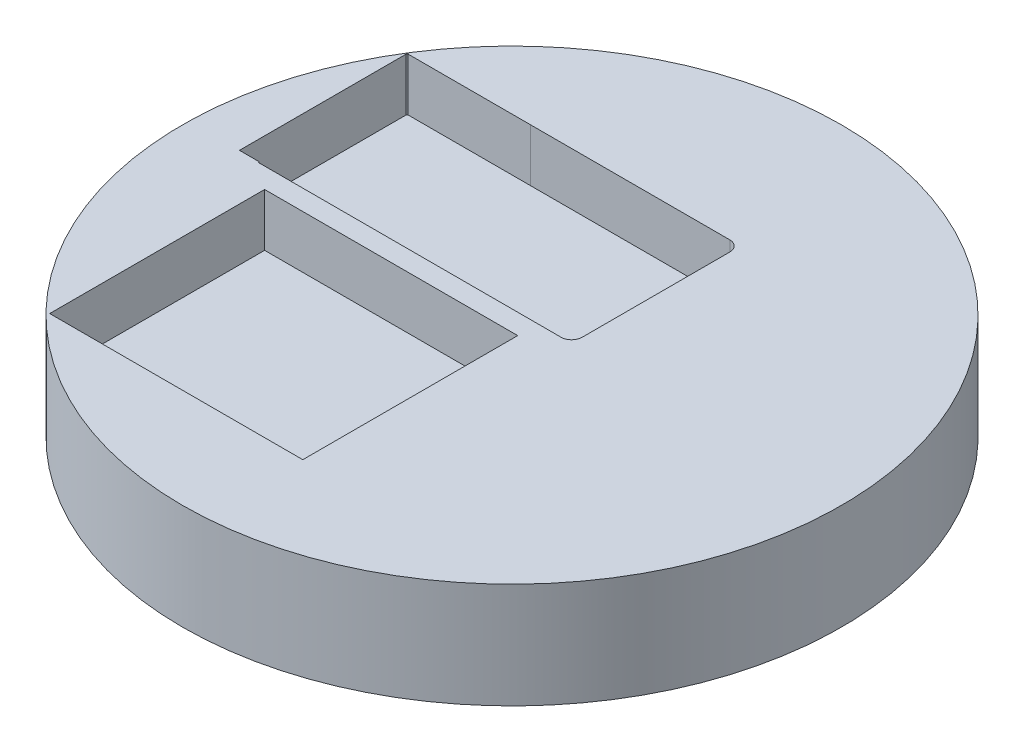
from build123d import *

# Parameters (mm, degrees)
SKETCH1_R           = 79.375
BOSS_EXTRUDE1_DEPTH = 25.4
CUT_EXTRUDE1_DEPTH  = 12.7


with BuildPart() as part:
    # Sketch1 → Boss-Extrude1 (new body)
    with BuildSketch(Plane(origin=(0, 0, 0), x_dir=(1, 0, 0), z_dir=(0, 1, 0))):
        with Locations(Location((0, 0, 0), (0, 0, 270))):
            Circle(SKETCH1_R)
    extrude(amount=BOSS_EXTRUDE1_DEPTH)

    # Sketch2 → Cut-Extrude1 (cut)
    with BuildSketch(Plane(origin=(0, 25.4, 0), x_dir=(1, 0, 0), z_dir=(0, 1, 0))):
        Polygon((4.96096917, -3.583661606), (4.96096917, -7.48907527), (4.96096917, -8.37807527), (4.96096917, -50.554447942), (4.96096917, -51.443447942), (4.96096917, -55.348861606), (-55.99903083, -55.348861606), (-55.99903083, -51.443447942), (-55.99903083, -50.554447942), (-55.99903083, -8.37807527), (-55.99903083, -7.48907527), (-55.99903083, -3.583661606), align=None)
        with BuildLine():
            Line((13.069814764, 39.393138394), (13.069814764, 3.833138394))
            ThreePointArc((13.069814764, 3.833138394), (12.325865988, 2.03708717), (10.529814764, 1.293138394))
            Line((10.529814764, 1.293138394), (-37.221874349, 1.293138394))
            Line((-37.221874349, 1.293138394), (-37.475874266, 1.293138394))
            Line((-37.475874266, 1.293138394), (-62.366588392, 1.293138394))
            Line((-62.366588392, 1.293138394), (-62.426979393, 1.547138394))
            Line((-62.426979393, 1.547138394), (-67.193874266, 1.547138394))
            Line((-67.193874266, 1.547138394), (-67.193874266, 16.202925843))
            Line((-67.193874266, 16.202925843), (-67.193874266, 27.023351013))
            Line((-67.193874266, 27.023351013), (-67.193874266, 41.679138428))
            Line((-67.193874266, 41.679138428), (-66.939875034, 41.933134494))
            Line((-66.939875034, 41.933134494), (-62.366588392, 41.9331351))
            Line((-62.366588392, 41.9331351), (-37.475874266, 41.933138394))
            Line((-37.475874266, 41.933138394), (-37.221874349, 41.933138394))
            Line((-37.221874349, 41.933138394), (10.529814764, 41.933138394))
            ThreePointArc((10.529814764, 41.933138394), (12.325865988, 41.189189618), (13.069814764, 39.393138394))
        make_face()
    extrude(amount=-CUT_EXTRUDE1_DEPTH, mode=Mode.SUBTRACT)


solid = part.part
